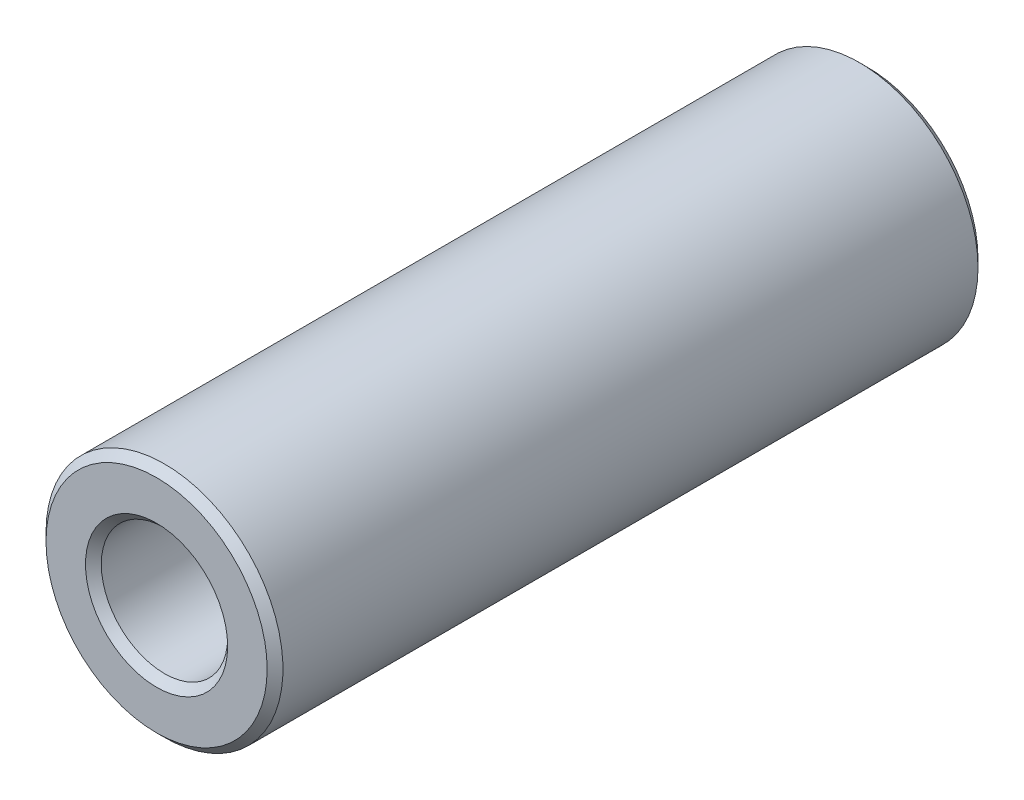
from build123d import *

# Parameters (mm, degrees)
SKETCH_1_R      = 7.5
SKETCH_1_R_2    = 4
EXTRUDE_1_DEPTH = 45
CHAMFER_1_SIZE  = 0.5


with BuildPart() as part:
    # Эскиз1 → Бобышка-Вытянуть1 (new body)
    with BuildSketch(Plane.XY):
        with Locations(Location((0, 0, 0), (0, 0, 180))):
            Circle(SKETCH_1_R)
        with Locations(Location((0, 0, 0), (0, 0, 180))):
            Circle(SKETCH_1_R_2, mode=Mode.SUBTRACT)
    extrude(amount=EXTRUDE_1_DEPTH)

    # Фаска1
    chamfer_1_edges = [part.edges().sort_by_distance(p)[0] for p in [
        (7.5, 0, 0),
        (7.5, 0, 45),
        (4, 0, 0),
        (4, 0, 45),
    ]]
    chamfer(chamfer_1_edges, length=CHAMFER_1_SIZE)


solid = part.part
